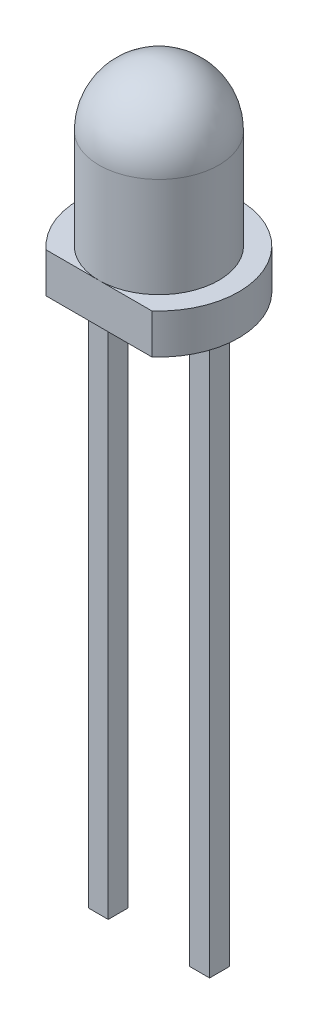
from build123d import *

# Parameters (mm, degrees)
BOSS_EXTRUDE1_DEPTH   = 1
SKETCH3_W             = 0.5
SKETCH3_H             = 0.5
BOSS_EXTRUDE2_DEPTH   = 14
BOSS_EXTRUDE2_2_DEPTH = 14


with BuildPart() as part:
    # Sketch1 → Revolve1 (revolve)
    with BuildSketch(Plane(origin=(0, 0, 0), x_dir=(0, 0, -1), z_dir=(1, 0, 0))):
        with BuildLine():
            Line((-1.5, 0), (-1.5, 3.5))
            ThreePointArc((-1.5, 3.5), (-1.060660172, 4.560660172), (0, 5))
            Line((0, 5), (0, 0))
            Line((0, 0), (-1.5, 0))
        make_face()
    revolve(axis=Axis((0, 5, 0), (0, -1, 0)))

    # Sketch2 → Boss-Extrude1 (add)
    with BuildSketch(Plane(origin=(0, 0, 0), x_dir=(1, 0, 0), z_dir=(0, 1, 0))):
        with BuildLine():
            Line((-1.322875656, -1.5), (1.322875656, -1.5))
            ThreePointArc((1.322875656, -1.5), (0, 2), (-1.322875656, -1.5))
        make_face()
    extrude(amount=BOSS_EXTRUDE1_DEPTH)


with BuildPart() as body_2:
    # Sketch3 → Boss-Extrude2 (new body)
    with BuildSketch(Plane.XZ):
        with Locations((-1.27, 0)):
            Rectangle(SKETCH3_W, SKETCH3_H)
    extrude(amount=BOSS_EXTRUDE2_DEPTH)


with BuildPart() as body_3:
    # Sketch3 → Boss-Extrude2 2 (new body)
    with BuildSketch(Plane.XZ):
        with Locations((1.27, 0)):
            Rectangle(SKETCH3_W, SKETCH3_H)
    extrude(amount=BOSS_EXTRUDE2_2_DEPTH)


solid = Compound([part.part, body_2.part, body_3.part])
